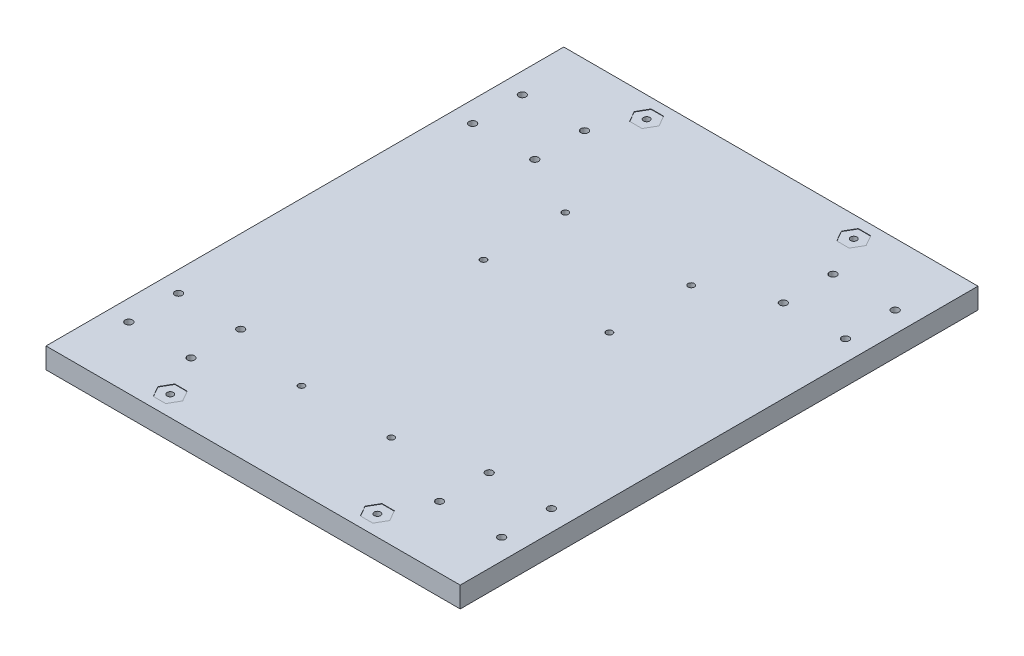
from build123d import *

# Parameters (mm, degrees)
SKETCH_1_W          = 200
SKETCH_1_H          = 250
SKETCH_1_R          = 4
EXTRUDE_1_DEPTH     = 10
EXTRUDE_START       = -15
SKETCH_2_R          = 4
EXTRUDE_3_DEPTH     = 15
CUT_EXTRUDE_1_DEPTH = 0.2
SKETCH_4_R          = 1.525
CUT_EXTRUDE_2_DEPTH = 321.507410211
SKETCH_5_R          = 1.5
CUT_EXTRUDE_3_DEPTH = 321.507410211
SKETCH_6_R          = 1.75
CUT_EXTRUDE_4_DEPTH = 321.507410211
SKETCH_7_R          = 1.5
CUT_EXTRUDE_5_DEPTH = 321.507410211


with BuildPart() as part:
    # 草图1 → 凸台-拉伸1 (new body)
    with BuildSketch(Plane(origin=(0, 0, 0), x_dir=(1, 0, 0), z_dir=(0, 1, 0))):
        with Locations((100, -125)):
            Rectangle(SKETCH_1_W, SKETCH_1_H)
        with Locations(Location((180, -15, 0), (0, 0, 270))):
            Circle(SKETCH_1_R, mode=Mode.SUBTRACT)
        with Locations(Location((180, -235, 0), (0, 0, 90))):
            Circle(SKETCH_1_R, mode=Mode.SUBTRACT)
        with Locations(Location((20, -15, 0), (0, 0, 90))):
            Circle(SKETCH_1_R, mode=Mode.SUBTRACT)
        with Locations(Location((20, -235, 0), (0, 0, 270))):
            Circle(SKETCH_1_R, mode=Mode.SUBTRACT)
    extrude(amount=EXTRUDE_1_DEPTH)

    # 草图2 → 凸台-拉伸3 (add)
    with BuildSketch(Plane(origin=(0, 10, 0), x_dir=(1, 0, 0), z_dir=(0, 1, 0)).offset(EXTRUDE_START)):
        with Locations(Location((180, -235, 0), (0, 0, 270))):
            Circle(SKETCH_2_R)
        with Locations(Location((20, -235, 0), (0, 0, 270))):
            Circle(SKETCH_2_R)
        with Locations(Location((180, -15, 0), (0, 0, 270))):
            Circle(SKETCH_2_R)
        with Locations(Location((20, -15, 0), (0, 0, 270))):
            Circle(SKETCH_2_R)
    extrude(amount=EXTRUDE_3_DEPTH)

    # 草图3 → 切除-拉伸1 (cut)
    with BuildSketch(Plane(origin=(0, 10, 0), x_dir=(1, 0, 0), z_dir=(0, 1, 0))):
        Polygon((56, -240), (53, -234.803847577), (47, -234.803847577), (44, -240), (47, -245.196152423), (53, -245.196152423), align=None)
        Polygon((147, -245.196152423), (144, -240), (147, -234.803847577), (153, -234.803847577), (156, -240), (153, -245.196152423), align=None)
        Polygon((144, -10), (147, -15.196152423), (153, -15.196152423), (156, -10), (153, -4.803847577), (147, -4.803847577), align=None)
        Polygon((53, -4.803847577), (56, -10), (53, -15.196152423), (47, -15.196152423), (44, -10), (47, -4.803847577), align=None)
    extrude(amount=-CUT_EXTRUDE_1_DEPTH, mode=Mode.SUBTRACT)

    # 草图4 → 切除-拉伸2 (cut, through all)
    with BuildSketch(Plane(origin=(0, 10, 0), x_dir=(1, 0, 0), z_dir=(0, 1, 0))):
        with Locations(Location((150, -10, 0), (0, 0, 270))):
            Circle(SKETCH_4_R)
        with Locations(Location((50, -10, 0), (0, 0, 270))):
            Circle(SKETCH_4_R)
        with Locations(Location((50, -240, 0), (0, 0, 270))):
            Circle(SKETCH_4_R)
        with Locations(Location((150, -240, 0), (0, 0, 270))):
            Circle(SKETCH_4_R)
    extrude(amount=-CUT_EXTRUDE_2_DEPTH, mode=Mode.SUBTRACT)

    # 草图5 → 切除-拉伸3 (cut, through all)
    with BuildSketch(Plane(origin=(0, 10, 0), x_dir=(1, 0, 0), z_dir=(0, 1, 0))):
        with Locations(Location((69.6, -68.863237915, 0), (0, 0, 270))):
            Circle(SKETCH_5_R)
        with Locations(Location((69.6, -108.363237915, 0), (0, 0, 270))):
            Circle(SKETCH_5_R)
        with Locations(Location((130.4, -108.363237915, 0), (0, 0, 270))):
            Circle(SKETCH_5_R)
        with Locations(Location((130.4, -68.863237915, 0), (0, 0, 270))):
            Circle(SKETCH_5_R)
    extrude(amount=-CUT_EXTRUDE_3_DEPTH, mode=Mode.SUBTRACT)

    # 草图6 → 切除-拉伸4 (cut, through all)
    with BuildSketch(Plane(origin=(0, 10, 0), x_dir=(1, 0, 0), z_dir=(0, 1, 0))):
        with Locations(Location((190, -54, 0), (0, 0, 270))):
            Circle(SKETCH_6_R)
        with Locations(Location((160, -54, 0), (0, 0, 270))):
            Circle(SKETCH_6_R)
        with Locations(Location((160, -30, 0), (0, 0, 270))):
            Circle(SKETCH_6_R)
        with Locations(Location((190, -30, 0), (0, 0, 270))):
            Circle(SKETCH_6_R)
        with Locations(Location((190, -220, 0), (0, 0, 270))):
            Circle(SKETCH_6_R)
        with Locations(Location((160, -220, 0), (0, 0, 270))):
            Circle(SKETCH_6_R)
        with Locations(Location((160, -196, 0), (0, 0, 270))):
            Circle(SKETCH_6_R)
        with Locations(Location((190, -196, 0), (0, 0, 270))):
            Circle(SKETCH_6_R)
        with Locations(Location((40, -54, 0), (0, 0, 270))):
            Circle(SKETCH_6_R)
        with Locations(Location((10, -54, 0), (0, 0, 270))):
            Circle(SKETCH_6_R)
        with Locations(Location((10, -30, 0), (0, 0, 270))):
            Circle(SKETCH_6_R)
        with Locations(Location((40, -30, 0), (0, 0, 270))):
            Circle(SKETCH_6_R)
        with Locations(Location((40, -220, 0), (0, 0, 270))):
            Circle(SKETCH_6_R)
        with Locations(Location((10, -220, 0), (0, 0, 270))):
            Circle(SKETCH_6_R)
        with Locations(Location((10, -196, 0), (0, 0, 270))):
            Circle(SKETCH_6_R)
        with Locations(Location((40, -196, 0), (0, 0, 270))):
            Circle(SKETCH_6_R)
    extrude(amount=-CUT_EXTRUDE_4_DEPTH, mode=Mode.SUBTRACT)

    # 草图7 → 切除-拉伸5 (cut, through all)
    with BuildSketch(Plane(origin=(0, 10, 0), x_dir=(1, 0, 0), z_dir=(0, 1, 0))):
        with Locations(Location((121.65, -205, 0), (0, 0, 270))):
            Circle(SKETCH_7_R)
        with Locations(Location((78.35, -205, 0), (0, 0, 270))):
            Circle(SKETCH_7_R)
    extrude(amount=-CUT_EXTRUDE_5_DEPTH, mode=Mode.SUBTRACT)


solid = part.part
